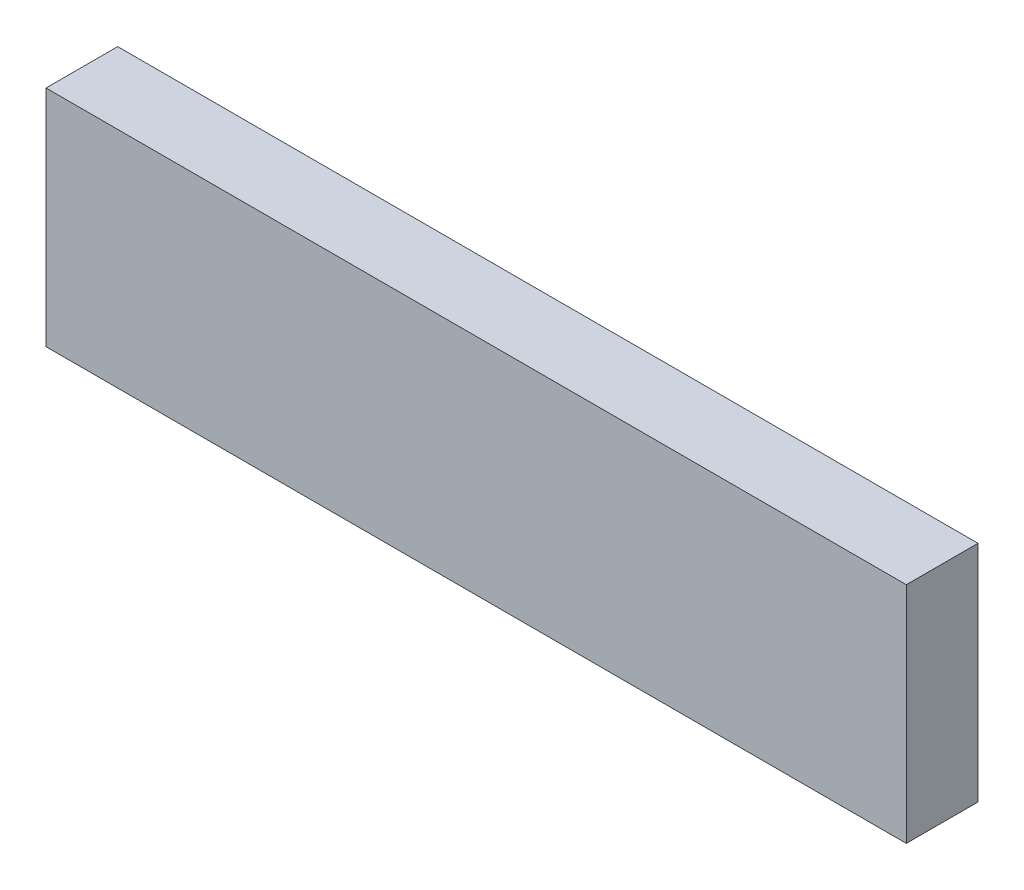
from build123d import *

# Parameters (mm, degrees)
SKETCH1_W           = 304.8
SKETCH1_H           = 25.4
BOSS_EXTRUDE1_DEPTH = 39.6875


with BuildPart() as part:
    # Sketch1 → Boss-Extrude1 (new, symmetric)
    with BuildSketch(Plane(origin=(0, 0, 0), x_dir=(1, 0, 0), z_dir=(0, 1, 0))):
        Rectangle(SKETCH1_W, SKETCH1_H)
    extrude(amount=BOSS_EXTRUDE1_DEPTH, both=True)


solid = part.part
